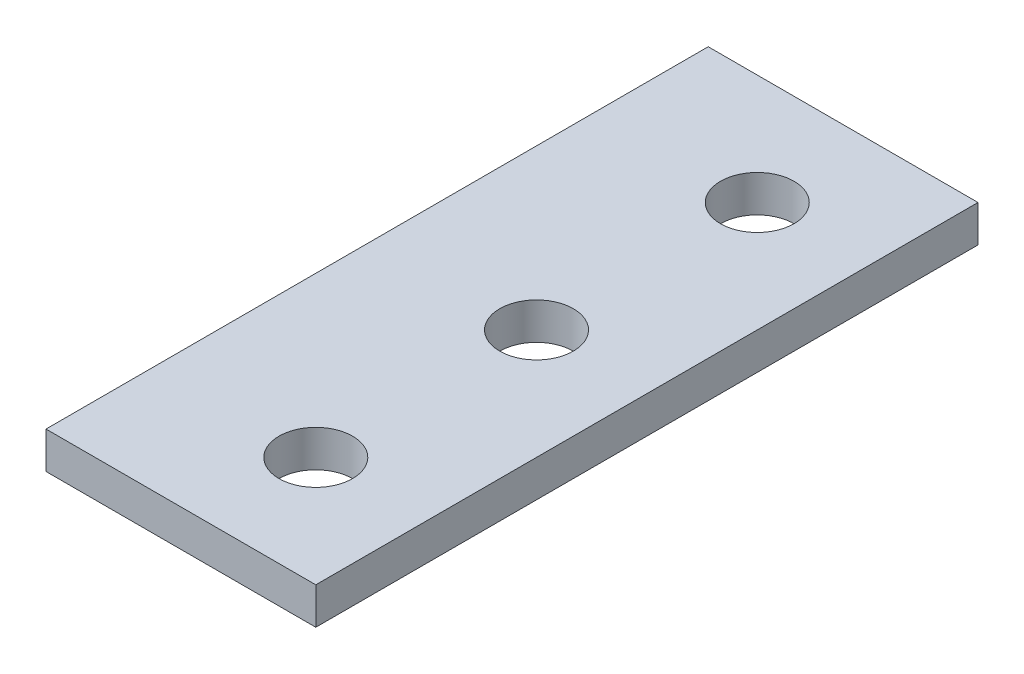
from build123d import *

# Parameters (mm, degrees)
SKETCH1_W           = 66
SKETCH1_H           = 162
SKETCH1_R           = 9
BOSS_EXTRUDE2_DEPTH = 4.5


with BuildPart() as part:
    # Sketch1 → Boss-Extrude2 (new, symmetric)
    with BuildSketch(Plane(origin=(0, 0, 0), x_dir=(1, 0, 0), z_dir=(0, 1, 0))):
        with Locations((33, -81)):
            Rectangle(SKETCH1_W, SKETCH1_H)
        with Locations(Location((39, -135, 0), (0, 0, 270))):
            Circle(SKETCH1_R, mode=Mode.SUBTRACT)
        with Locations(Location((39, -81, 0), (0, 0, 270))):
            Circle(SKETCH1_R, mode=Mode.SUBTRACT)
        with Locations(Location((39, -27, 0), (0, 0, 270))):
            Circle(SKETCH1_R, mode=Mode.SUBTRACT)
    extrude(amount=BOSS_EXTRUDE2_DEPTH, both=True)


solid = part.part
